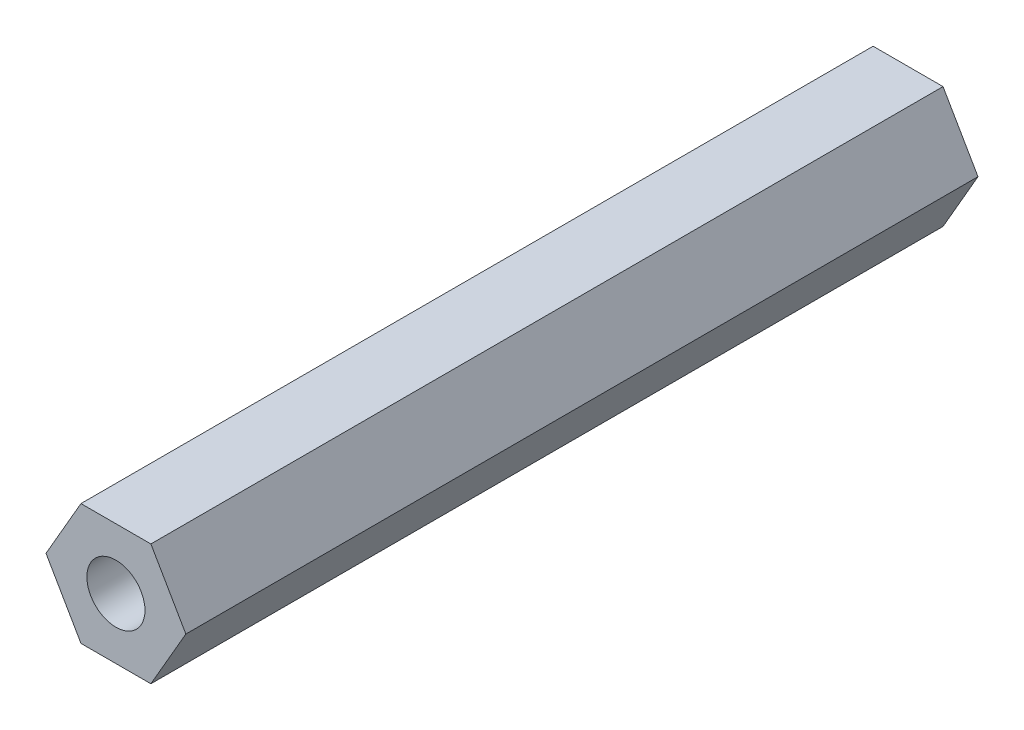
from build123d import *

# Parameters (mm, degrees)
EXTRUDE_340_DEPTH = 22.5


with BuildPart() as part:
    # 草图1 → Extrude 340 (new, symmetric)
    with BuildSketch(Plane.XY):
        Polygon((1.986084926, 3.44), (-1.986084926, 3.44), (-3.972169852, 0), (-1.986084926, -3.44), (1.986084926, -3.44), (3.972169852, 0), align=None)
    extrude(amount=EXTRUDE_340_DEPTH, both=True)

    # 草图3 → 螺纹孔1 (revolve, cut)
    with BuildSketch(Plane(origin=(0, 0, 22.5), x_dir=(0, -1, 0), z_dir=(1, 0, 0))):
        Polygon((0, 0), (0, 14.191420021), (1.65, 13.2), (1.65, 0), align=None)
    hole_wizard_1 = revolve(axis=Axis((0, 0, 28.85), (0, 0, -1)), mode=Mode.SUBTRACT)

    # 镜向1: 螺纹孔1 across plane
    add(hole_wizard_1.mirror(Plane.XY), mode=Mode.SUBTRACT)


solid = part.part
